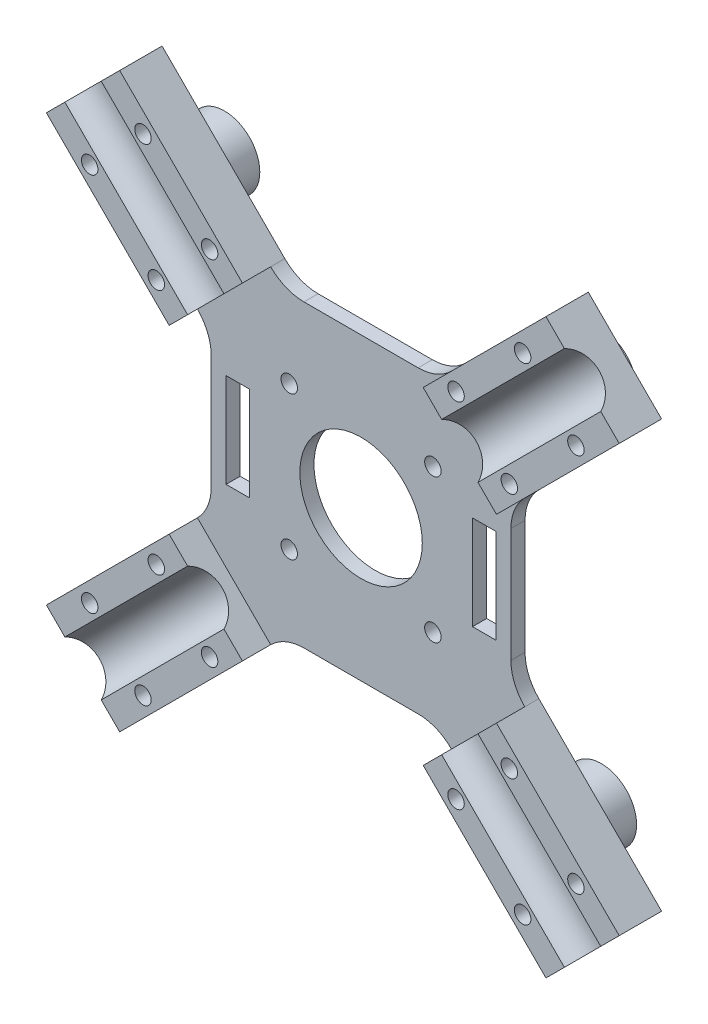
from build123d import *

# Parameters (mm, degrees)
SKETCH1_R               = 1.75
SKETCH1_W               = 5
SKETCH1_H               = 20
SKETCH1_R_2             = 13
BOSS_EXTRUDE1_DEPTH     = 3
SKETCH3_R               = 7.5
SKETCH3_R_2             = 4.75
BOSS_EXTRUDE2_DEPTH     = 8
BOSS_EXTRUDE4_DEPTH     = 6
CUT_EXTRUDE3_DEPTH      = 21
CUT_EXTRUDE3_DEPTH_BACK = 10
SKETCH1_5_R             = 1.75
CUT_EXTRUDE4_REACH      = 163.251
SKETCH10_R              = 6
CUT_EXTRUDE5_REACH      = 163.251
SKETCH11_R              = 6


with BuildPart() as part:
    # Sketch1 → Boss-Extrude1 (new body)
    with BuildSketch(Plane.XY):
        with BuildLine():
            Line((45.254833996, 60.811183182), (24.04163056, 39.597979746))
            Line((24.04163056, 39.597979746), (19.192388155, 34.748737342))
            ThreePointArc((19.192388155, 34.748737342), (15.948154667, 32.581009828), (12.121320344, 31.819805153))
            Line((12.121320344, 31.819805153), (-12.121320344, 31.819805153))
            ThreePointArc((-12.121320344, 31.819805153), (-15.948154667, 32.581009828), (-19.192388155, 34.748737342))
            Line((-19.192388155, 34.748737342), (-24.04163056, 39.597979746))
            Line((-24.04163056, 39.597979746), (-45.254833996, 60.811183182))
            Line((-45.254833996, 60.811183182), (-60.811183182, 45.254833996))
            Line((-60.811183182, 45.254833996), (-39.597979746, 24.04163056))
            Line((-39.597979746, 24.04163056), (-34.748737342, 19.192388155))
            ThreePointArc((-34.748737342, 19.192388155), (-32.581009828, 15.948154667), (-31.819805153, 12.121320344))
            Line((-31.819805153, 12.121320344), (-31.819805153, -12.121320344))
            ThreePointArc((-31.819805153, -12.121320344), (-32.581009828, -15.948154667), (-34.748737342, -19.192388155))
            Line((-34.748737342, -19.192388155), (-39.597979746, -24.04163056))
            Line((-39.597979746, -24.04163056), (-60.811183182, -45.254833996))
            Line((-60.811183182, -45.254833996), (-45.254833996, -60.811183182))
            Line((-45.254833996, -60.811183182), (-24.04163056, -39.597979746))
            Line((-24.04163056, -39.597979746), (-19.192388155, -34.748737342))
            ThreePointArc((-19.192388155, -34.748737342), (-15.948154667, -32.581009828), (-12.121320344, -31.819805153))
            Line((-12.121320344, -31.819805153), (12.121320344, -31.819805153))
            ThreePointArc((12.121320344, -31.819805153), (15.948154667, -32.581009828), (19.192388155, -34.748737342))
            Line((19.192388155, -34.748737342), (24.04163056, -39.597979746))
            Line((24.04163056, -39.597979746), (45.254833996, -60.811183182))
            Line((45.254833996, -60.811183182), (60.811183182, -45.254833996))
            Line((60.811183182, -45.254833996), (39.597979746, -24.04163056))
            Line((39.597979746, -24.04163056), (34.748737342, -19.192388155))
            ThreePointArc((34.748737342, -19.192388155), (32.581009828, -15.948154667), (31.819805153, -12.121320344))
            Line((31.819805153, -12.121320344), (31.819805153, 12.121320344))
            ThreePointArc((31.819805153, 12.121320344), (32.581009828, 15.948154667), (34.748737342, 19.192388155))
            Line((34.748737342, 19.192388155), (39.597979746, 24.04163056))
            Line((39.597979746, 24.04163056), (60.811183182, 45.254833996))
            Line((60.811183182, 45.254833996), (45.254833996, 60.811183182))
        make_face()
        with Locations((-40.305086528, -51.618795027)):
            Circle(SKETCH1_R, mode=Mode.SUBTRACT)
        with Locations((-51.618795027, -40.305086528)):
            Circle(SKETCH1_R, mode=Mode.SUBTRACT)
        with Locations((-26.162950904, -37.476659403)):
            Circle(SKETCH1_R, mode=Mode.SUBTRACT)
        with Locations((-37.476659403, -26.162950904)):
            Circle(SKETCH1_R, mode=Mode.SUBTRACT)
        with Locations((-15.25, -15.25)):
            Circle(SKETCH1_R, mode=Mode.SUBTRACT)
        with Locations((26.162950904, -37.476659403)):
            Circle(SKETCH1_R, mode=Mode.SUBTRACT)
        with Locations((40.305086528, -51.618795027)):
            Circle(SKETCH1_R, mode=Mode.SUBTRACT)
        with Locations((51.618795027, -40.305086528)):
            Circle(SKETCH1_R, mode=Mode.SUBTRACT)
        with Locations((15.25, -15.25)):
            Circle(SKETCH1_R, mode=Mode.SUBTRACT)
        with Locations((37.476659403, -26.162950904)):
            Circle(SKETCH1_R, mode=Mode.SUBTRACT)
        with Locations((-37.476659403, 26.162950904)):
            Circle(SKETCH1_R, mode=Mode.SUBTRACT)
        with Locations((-26.162950904, 0)):
            Rectangle(SKETCH1_W, SKETCH1_H, mode=Mode.SUBTRACT)
        with Locations((-15.25, 15.25)):
            Circle(SKETCH1_R, mode=Mode.SUBTRACT)
        with Locations((-51.618795027, 40.305086528)):
            Circle(SKETCH1_R, mode=Mode.SUBTRACT)
        with Locations((-40.305086528, 51.618795027)):
            Circle(SKETCH1_R, mode=Mode.SUBTRACT)
        with Locations((-26.162950904, 37.476659403)):
            Circle(SKETCH1_R, mode=Mode.SUBTRACT)
        Circle(SKETCH1_R_2, mode=Mode.SUBTRACT)
        with Locations((26.162950904, 0)):
            Rectangle(SKETCH1_W, SKETCH1_H, mode=Mode.SUBTRACT)
        with Locations((15.25, 15.25)):
            Circle(SKETCH1_R, mode=Mode.SUBTRACT)
        with Locations((37.476659403, 26.162950904)):
            Circle(SKETCH1_R, mode=Mode.SUBTRACT)
        with Locations((26.162950904, 37.476659403)):
            Circle(SKETCH1_R, mode=Mode.SUBTRACT)
        with Locations((51.618795027, 40.305086528)):
            Circle(SKETCH1_R, mode=Mode.SUBTRACT)
        with Locations((40.305086528, 51.618795027)):
            Circle(SKETCH1_R, mode=Mode.SUBTRACT)
    extrude(amount=BOSS_EXTRUDE1_DEPTH)

    # Sketch3 → Boss-Extrude2 (add)
    # profile 1 of 4: a face of its own
    with BuildSketch(Plane.XY):
        with Locations((-40.001785669, 40.001785669)):
            Circle(SKETCH3_R)
        with Locations((-40.001785669, 40.001785669)):
            Circle(SKETCH3_R_2, mode=Mode.SUBTRACT)
    # profile 2 of 4: a face of its own
    with BuildSketch(Plane.XY):
        with Locations(Location((-40.001785669, -40.001785669, 0), (0, 0, 180))):
            Circle(SKETCH3_R)
        with Locations((-40.001785669, -40.001785669)):
            Circle(SKETCH3_R_2, mode=Mode.SUBTRACT)
    # profile 3 of 4: a face of its own
    with BuildSketch(Plane.XY):
        with Locations((40.001785669, -40.001785669)):
            Circle(SKETCH3_R)
        with Locations((40.001785669, -40.001785669)):
            Circle(SKETCH3_R_2, mode=Mode.SUBTRACT)
    # profile 4 of 4: a face of its own
    with BuildSketch(Plane.XY):
        with Locations(Location((40.001785669, 40.001785669, 0), (0, 0, 180))):
            Circle(SKETCH3_R)
        with Locations((40.001785669, 40.001785669)):
            Circle(SKETCH3_R_2, mode=Mode.SUBTRACT)
    extrude(amount=-BOSS_EXTRUDE2_DEPTH)

    # Sketch7 → Boss-Extrude4 (add)
    with BuildSketch(Plane.XY.offset(3)):
        Polygon((-34.748737342, 19.192388155), (-19.192388155, 34.748737342), (-45.254833996, 60.811183182), (-60.811183182, 45.254833996), align=None)
        Polygon((-60.811183182, -45.254833996), (-34.748737342, -19.192388155), (-19.192388155, -34.748737342), (-45.254833996, -60.811183182), align=None)
        Polygon((34.748737342, -19.192388155), (19.192388155, -34.748737342), (45.254833996, -60.811183182), (60.811183182, -45.254833996), align=None)
        Polygon((60.811183182, 45.254833996), (34.748737342, 19.192388155), (19.192388155, 34.748737342), (45.254833996, 60.811183182), align=None)
    extrude(amount=BOSS_EXTRUDE4_DEPTH)

    # Sketch1<5> → Cut-Extrude3 (cut, two sides: drawn at the far end of the back side and taken through both)
    with BuildSketch(Plane.XY.offset(-CUT_EXTRUDE3_DEPTH_BACK)):
        with Locations(Location((-37.476659403, -26.162950904, 0), (0, 0, 180))):
            Circle(SKETCH1_5_R)
        with Locations(Location((-26.162950904, -37.476659403, 0), (0, 0, 180))):
            Circle(SKETCH1_5_R)
        with Locations(Location((-40.305086528, -51.618795027, 0), (0, 0, 180))):
            Circle(SKETCH1_5_R)
        with Locations(Location((-51.618795027, -40.305086528, 0), (0, 0, 180))):
            Circle(SKETCH1_5_R)
        with Locations(Location((26.162950904, 37.476659403, 0), (0, 0, 180))):
            Circle(SKETCH1_5_R)
        with Locations(Location((37.476659403, 26.162950904, 0), (0, 0, 180))):
            Circle(SKETCH1_5_R)
        with Locations(Location((51.618795027, 40.305086528, 0), (0, 0, 180))):
            Circle(SKETCH1_5_R)
        with Locations(Location((40.305086528, 51.618795027, 0), (0, 0, 180))):
            Circle(SKETCH1_5_R)
        with Locations((40.305086528, -51.618795027)):
            Circle(SKETCH1_5_R)
        with Locations((51.618795027, -40.305086528)):
            Circle(SKETCH1_5_R)
        with Locations((37.476659403, -26.162950904)):
            Circle(SKETCH1_5_R)
        with Locations((26.162950904, -37.476659403)):
            Circle(SKETCH1_5_R)
        with Locations((-51.618795027, 40.305086528)):
            Circle(SKETCH1_5_R)
        with Locations((-40.305086528, 51.618795027)):
            Circle(SKETCH1_5_R)
        with Locations((-26.162950904, 37.476659403)):
            Circle(SKETCH1_5_R)
        with Locations((-37.476659403, 26.162950904)):
            Circle(SKETCH1_5_R)
    extrude(amount=CUT_EXTRUDE3_DEPTH + CUT_EXTRUDE3_DEPTH_BACK, mode=Mode.SUBTRACT)

    # Cut-Extrude4: up to this face of the body (flat: up to its plane)
    cut_extrude4_end = Plane(part.part.faces().sort_by_distance((53.033008589, -53.033008589, 4.5))[0])
    # Sketch10 → Cut-Extrude4 (cut, up to the picked face)
    with BuildSketch(Plane(origin=(-53.033008589, 53.033008589, 0), x_dir=(0, 0, 1), z_dir=(-0.7071067811865477, 0.7071067811865474, 0)), mode=Mode.PRIVATE) as cut_extrude4_sk1:
        with Locations((11.5, 0)):
            Circle(SKETCH10_R)
    cut_extrude4_tool1 = split(extrude(cut_extrude4_sk1.sketch, amount=-CUT_EXTRUDE4_REACH, mode=Mode.PRIVATE), bisect_by=cut_extrude4_end, keep=Keep.BOTH, mode=Mode.PRIVATE)
    add(cut_extrude4_tool1.solids().sort_by(Axis((-53.033009, 53.033009, 11.5), (0.7071067811865477, -0.7071067811865474, 0)))[0], mode=Mode.SUBTRACT)

    # Cut-Extrude5: up to this face of the body (flat: up to its plane)
    cut_extrude5_end = Plane(part.part.faces().sort_by_distance((-53.033008589, -53.033008589, 4.5))[0])
    # Sketch11 → Cut-Extrude5 (cut, up to the picked face)
    with BuildSketch(Plane(origin=(53.033008589, 53.033008589, 0), x_dir=(0.7071067811865552, -0.7071067811865398, 0), z_dir=(0.7071067811865398, 0.7071067811865552, 0)), mode=Mode.PRIVATE) as cut_extrude5_sk1:
        with Locations((0, -11.5)):
            Circle(SKETCH11_R)
    cut_extrude5_tool1 = split(extrude(cut_extrude5_sk1.sketch, amount=-CUT_EXTRUDE5_REACH, mode=Mode.PRIVATE), bisect_by=cut_extrude5_end, keep=Keep.BOTH, mode=Mode.PRIVATE)
    add(cut_extrude5_tool1.solids().sort_by(Axis((53.033009, 53.033009, 11.5), (-0.7071067811865398, -0.7071067811865552, 0)))[0], mode=Mode.SUBTRACT)


solid = part.part
